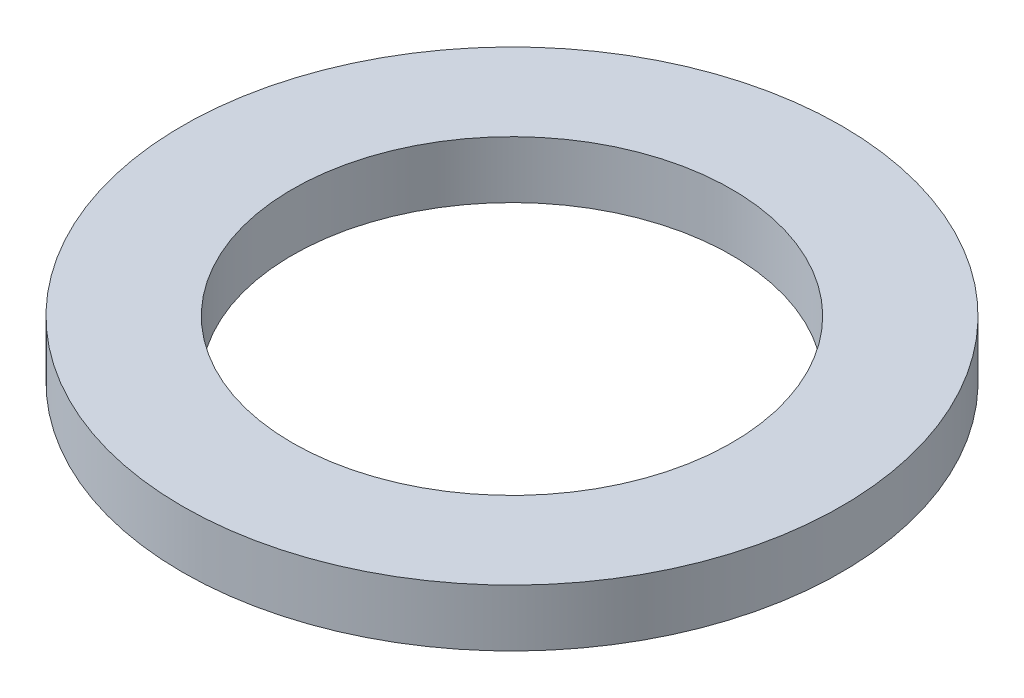
from build123d import *

# Parameters (mm, degrees)
SKETCH1_R           = 9.525
SKETCH1_R_2         = 6.35
BOSS_EXTRUDE1_DEPTH = 1.65


with BuildPart() as part:
    # Sketch1 → Boss-Extrude1 (new body)
    with BuildSketch(Plane(origin=(0, 0, 0), x_dir=(1, 0, 0), z_dir=(0, 1, 0))):
        with Locations(Location((0, 0, 0), (0, 0, 270))):
            Circle(SKETCH1_R)
        with Locations(Location((0, 0, 0), (0, 0, 270))):
            Circle(SKETCH1_R_2, mode=Mode.SUBTRACT)
    extrude(amount=BOSS_EXTRUDE1_DEPTH)


solid = part.part
